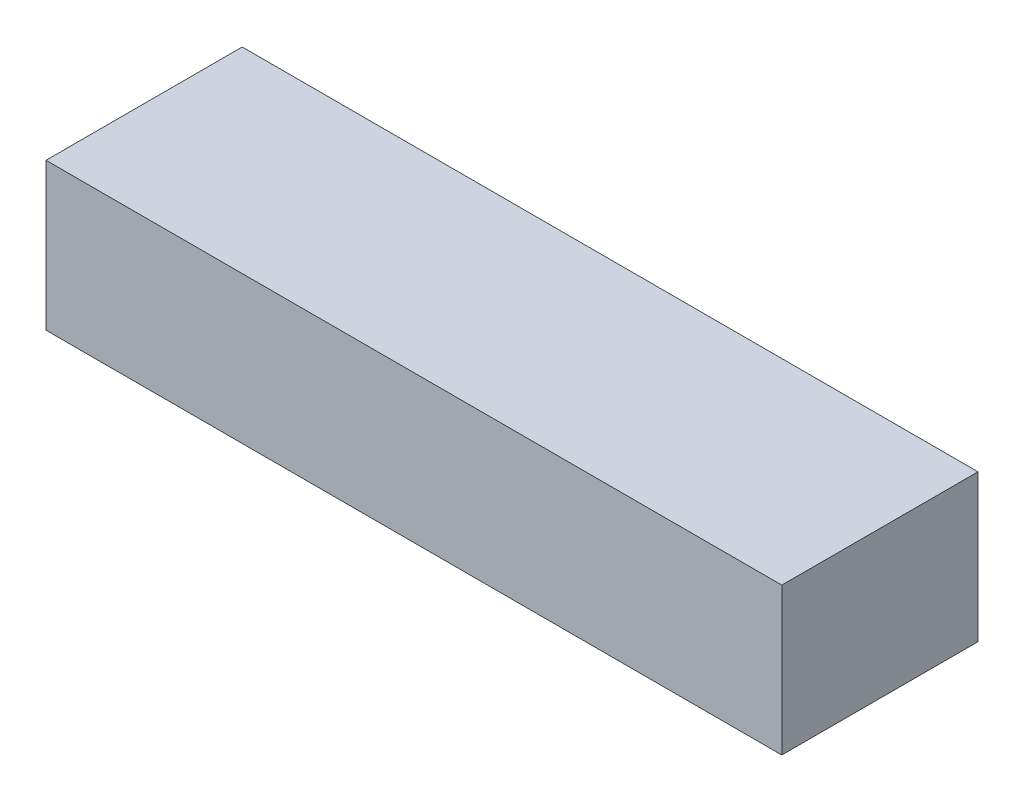
from build123d import *

# Parameters (mm, degrees)
SKETCH1_W           = 150
SKETCH1_H           = 40
BOSS_EXTRUDE1_DEPTH = 30


with BuildPart() as part:
    # Sketch1 → Boss-Extrude1 (new body)
    with BuildSketch(Plane(origin=(0, 0, 0), x_dir=(1, 0, 0), z_dir=(0, 1, 0))):
        Rectangle(SKETCH1_W, SKETCH1_H)
    extrude(amount=BOSS_EXTRUDE1_DEPTH)


solid = part.part
